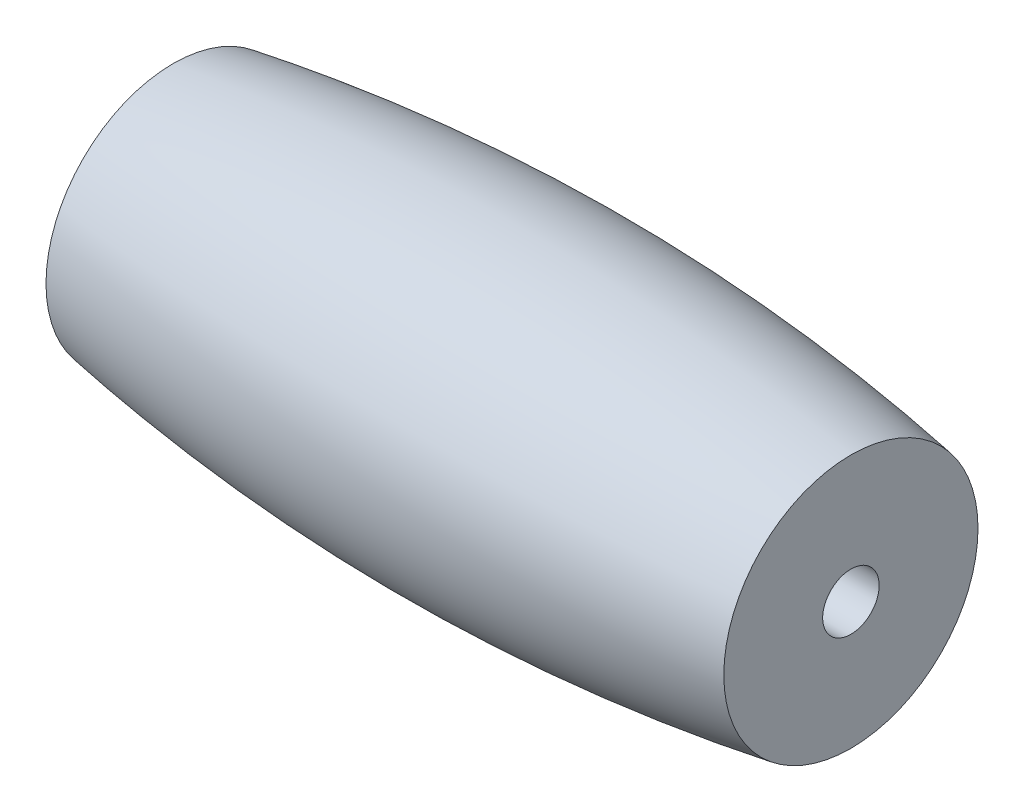
from build123d import *


with BuildPart() as part:
    # Sketch1 → Revolve1 (revolve)
    with BuildSketch(Plane.XY, mode=Mode.PRIVATE) as revolve1_sk:
        with BuildLine():
            Line((-40.458333333, 2), (7.541666667, 2))
            Line((7.541666667, 2), (7.541666667, 9))
            ThreePointArc((7.541666667, 9), (-16.458333333, 11), (-40.458333333, 9))
            Line((-40.458333333, 9), (-40.458333333, 2))
        make_face()
    revolve(revolve1_sk.sketch.rotate(Axis((11.25, 0, 0), (-1, 0, 0)), 90), axis=Axis((11.25, 0, 0), (-1, 0, 0)))


solid = part.part
